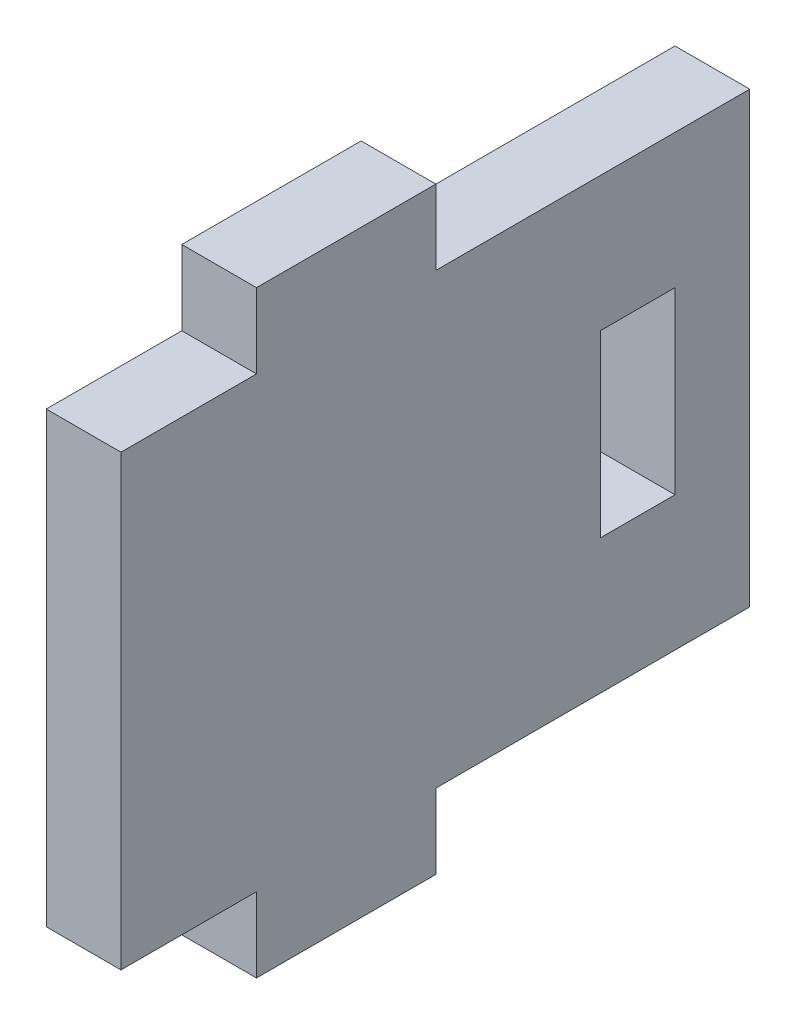
from build123d import *

# Parameters (mm, degrees)
SKETCH1_W           = 5
SKETCH1_H           = 12
BOSS_EXTRUDE1_DEPTH = 5


with BuildPart() as part:
    # Sketch1 → Boss-Extrude1 (new body)
    with BuildSketch(Plane(origin=(0, 0, 0), x_dir=(0, 0, -1), z_dir=(1, 0, 0))):
        Polygon((0, 15), (9.066386299, 15), (9.066386299, 20), (21.066386299, 20), (21.066386299, 15), (42.066386299, 15), (42.066386299, -15), (21.066386299, -15), (21.066386299, -20), (9.066386299, -20), (9.066386299, -15), (0, -15), align=None)
        with Locations((34.566386299, 0)):
            Rectangle(SKETCH1_W, SKETCH1_H, mode=Mode.SUBTRACT)
    extrude(amount=BOSS_EXTRUDE1_DEPTH)


solid = part.part
